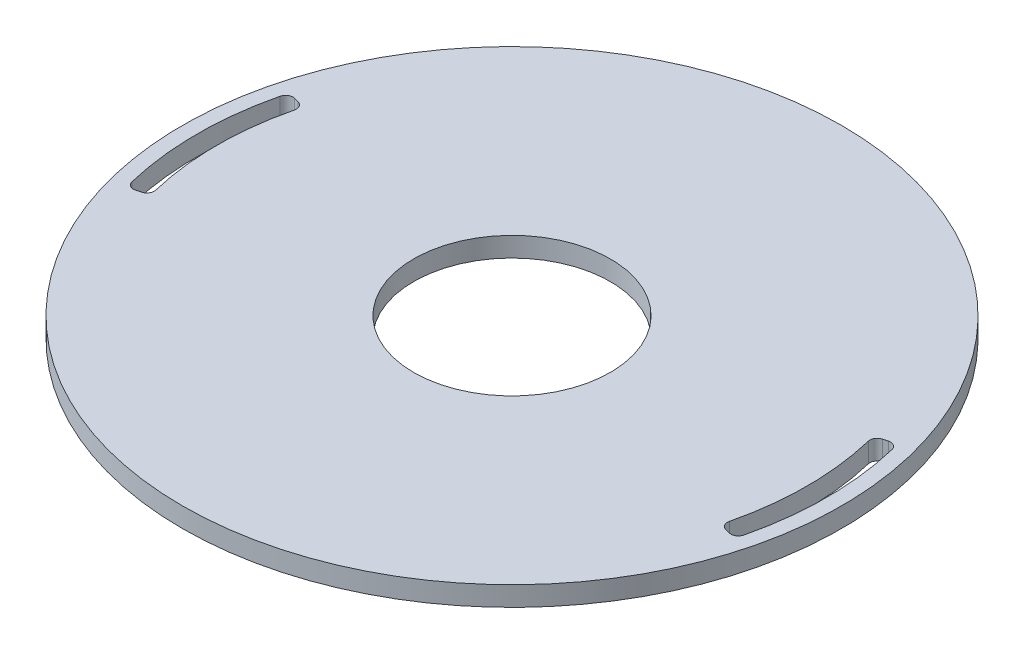
from build123d import *

# Parameters (mm, degrees)
SKETCH_1_R          = 33.5
SKETCH_1_R_2        = 10
EXTRUDE_1_DEPTH     = 2
SKETCH_2_R          = 1.25
EXTRUDE_2_DEPTH     = 2.5
CUT_EXTRUDE_1_DEPTH = 2
SKETCH_4_R          = 20.5
SKETCH_4_R_2        = 19
EXTRUDE_3_DEPTH     = 4
SKETCH_5_R          = 1.25
EXTRUDE_4_DEPTH     = 2.5


with BuildPart() as part:
    # Эскиз1 → Бобышка-Вытянуть1 (new body)
    with BuildSketch(Plane(origin=(0, 0, 0), x_dir=(1, 0, 0), z_dir=(0, 1, 0))):
        with Locations(Location((0, 0, 0), (0, 0, 270))):
            Circle(SKETCH_1_R)
        with Locations(Location((0, 0, 0), (0, 0, 270))):
            Circle(SKETCH_1_R_2, mode=Mode.SUBTRACT)
    extrude(amount=EXTRUDE_1_DEPTH)

    # Эскиз2 → Бобышка-Вытянуть2 (add)
    with BuildSketch(Plane.XZ):
        with Locations(Location((0, 25, 0), (0, 0, 90))):
            Circle(SKETCH_2_R)
        with Locations(Location((-25, 0, 0), (0, 0, 90))):
            Circle(SKETCH_2_R)
        with Locations(Location((25, 0, 0), (0, 0, 90))):
            Circle(SKETCH_2_R)
        with Locations(Location((0, -25, 0), (0, 0, 90))):
            Circle(SKETCH_2_R)
    extrude(amount=EXTRUDE_2_DEPTH)

    # Эскиз3 → Вырез-Вытянуть1 (cut)
    with BuildSketch(Plane(origin=(0, 2, 0), x_dir=(1, 0, 0), z_dir=(0, 1, 0))):
        with BuildLine():
            Line((-29.693383157, 7.956318037), (-30.176487487, 8.085765453))
            ThreePointArc((-30.176487487, 8.085765453), (-30.753369556, 8.006293038), (-31.099496213, 7.537992789))
            ThreePointArc((-31.099496213, 7.537992789), (-32, 0), (-31.099496213, -7.537992789))
            ThreePointArc((-31.099496213, -7.537992789), (-30.753369556, -8.006293038), (-30.176487487, -8.085765453))
            Line((-30.176487487, -8.085765453), (-29.693383157, -7.956318037))
            ThreePointArc((-29.693383157, -7.956318037), (-29.242600206, -7.614767331), (-29.158534088, -7.055486505))
            ThreePointArc((-29.158534088, -7.055486505), (-30, 0), (-29.158534088, 7.055486505))
            ThreePointArc((-29.158534088, 7.055486505), (-29.242600206, 7.614767331), (-29.693383157, 7.956318037))
        make_face()
        with BuildLine():
            Line((29.693383157, -7.956318037), (30.176487487, -8.085765453))
            ThreePointArc((30.176487487, -8.085765453), (30.753369556, -8.006293038), (31.099496213, -7.537992789))
            ThreePointArc((31.099496213, -7.537992789), (32, 0), (31.099496213, 7.537992789))
            ThreePointArc((31.099496213, 7.537992789), (30.753369556, 8.006293038), (30.176487487, 8.085765453))
            Line((30.176487487, 8.085765453), (29.693383157, 7.956318037))
            ThreePointArc((29.693383157, 7.956318037), (29.242600206, 7.614767331), (29.158534088, 7.055486505))
            ThreePointArc((29.158534088, 7.055486505), (30, 0), (29.158534088, -7.055486505))
            ThreePointArc((29.158534088, -7.055486505), (29.242600206, -7.614767331), (29.693383157, -7.956318037))
        make_face()
    extrude(amount=-CUT_EXTRUDE_1_DEPTH, mode=Mode.SUBTRACT)

    # Эскиз4 → Бобышка-Вытянуть3 (add)
    with BuildSketch(Plane.XZ):
        with Locations(Location((0, 0, 0), (0, 0, 90))):
            Circle(SKETCH_4_R)
        with Locations(Location((0, 0, 0), (0, 0, 270))):
            Circle(SKETCH_4_R_2, mode=Mode.SUBTRACT)
    extrude(amount=EXTRUDE_3_DEPTH)

    # Эскиз5 → Бобышка-Вытянуть4 (add)
    with BuildSketch(Plane.XZ):
        with Locations(Location((0, 14.5, 0), (0, 0, 90))):
            Circle(SKETCH_5_R)
        with Locations(Location((14.5, 0, 0), (0, 0, 90))):
            Circle(SKETCH_5_R)
        with Locations(Location((0, -14.5, 0), (0, 0, 90))):
            Circle(SKETCH_5_R)
        with Locations(Location((-14.5, 0, 0), (0, 0, 90))):
            Circle(SKETCH_5_R)
    extrude(amount=EXTRUDE_4_DEPTH)


solid = part.part
